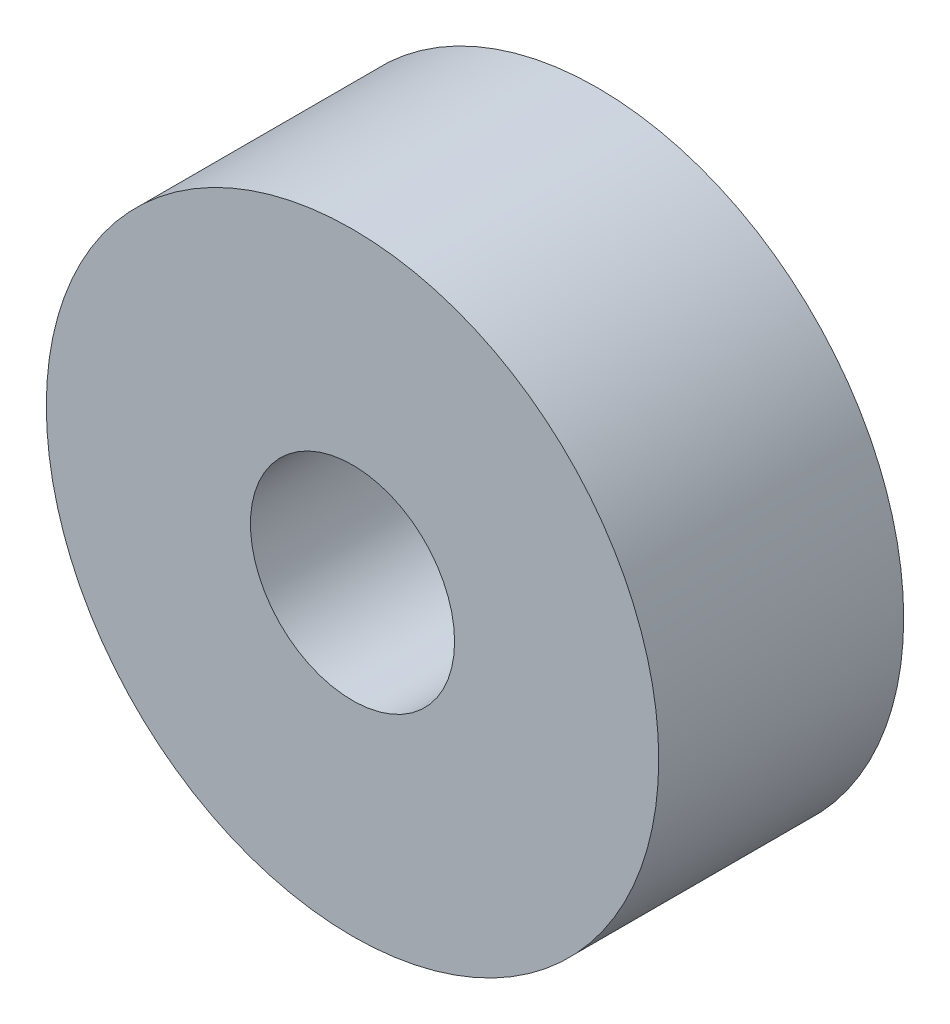
from build123d import *

# Parameters (mm, degrees)
SKETCH1_R           = 75
BOSS_EXTRUDE1_DEPTH = 60
SKETCH2_R           = 25
CUT_EXTRUDE1_DEPTH  = 50


with BuildPart() as part:
    # Sketch1 → Boss-Extrude1 (new body)
    with BuildSketch(Plane.XY):
        Circle(SKETCH1_R)
    extrude(amount=BOSS_EXTRUDE1_DEPTH)

    # Sketch2 → Cut-Extrude1 (cut)
    with BuildSketch(Plane.XY.offset(60)):
        Circle(SKETCH2_R)
    extrude(amount=-CUT_EXTRUDE1_DEPTH, mode=Mode.SUBTRACT)


solid = part.part
